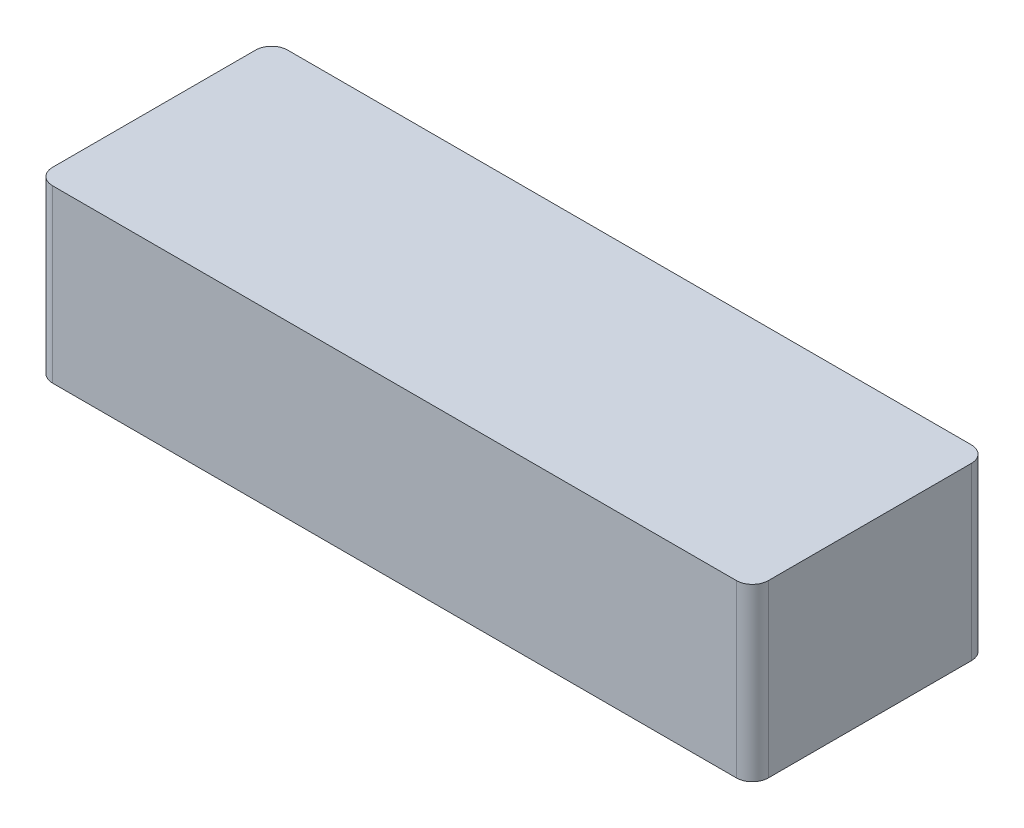
from build123d import *

# Parameters (mm, degrees)
BOSS_EXTRUDE2_DEPTH = 32


with BuildPart() as part:
    # Sketch1 → Boss-Extrude2 (new body)
    with BuildSketch(Plane(origin=(0, 0, 0), x_dir=(1, 0, 0), z_dir=(0, 1, 0))):
        with BuildLine():
            Line((-64, 22), (64, 22))
            ThreePointArc((64, 22), (66.121320344, 21.121320344), (67, 19))
            Line((67, 19), (67, -19))
            ThreePointArc((67, -19), (66.121320344, -21.121320344), (64, -22))
            Line((64, -22), (-64, -22))
            ThreePointArc((-64, -22), (-66.121320344, -21.121320344), (-67, -19))
            Line((-67, -19), (-67, 19))
            ThreePointArc((-67, 19), (-66.121320344, 21.121320344), (-64, 22))
        make_face()
    extrude(amount=BOSS_EXTRUDE2_DEPTH)


solid = part.part
